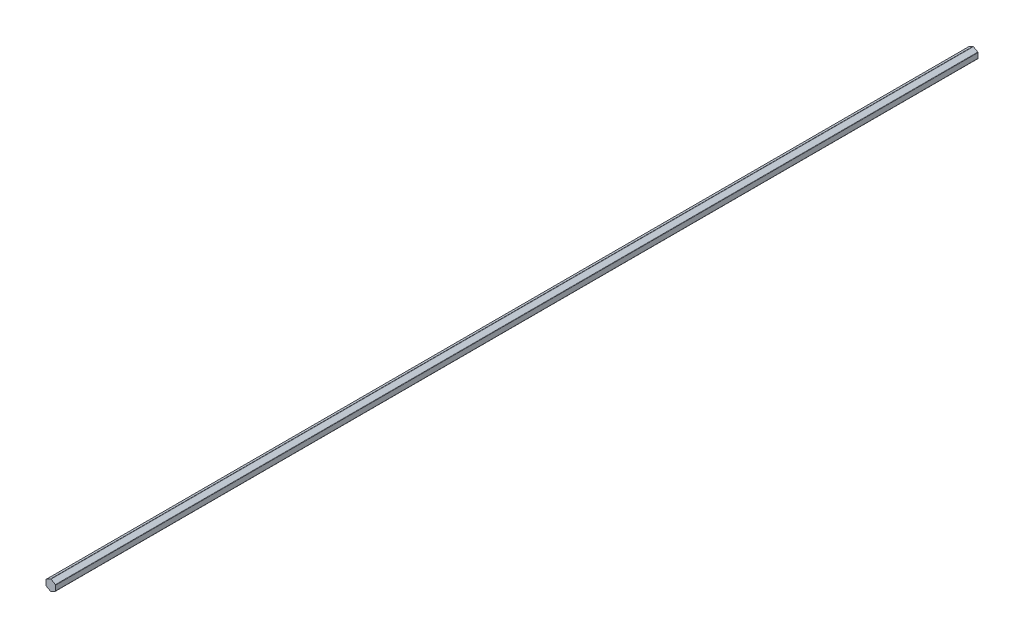
from build123d import *

# Parameters (mm, degrees)
SHAFT_BOSS_DEPTH = 914.4
FILLET1_R        = 0.508


with BuildPart() as part:
    # Sketch1 → Shaft Boss (new body)
    with BuildSketch(Plane.XY):
        Polygon((0, 5.499261314), (-4.7625, 2.749630657), (-4.7625, -2.749630657), (0, -5.499261314), (4.7625, -2.749630657), (4.7625, 2.749630657), align=None)
    extrude(amount=SHAFT_BOSS_DEPTH)

    # Fillet1
    fillet1_edges = [part.edges().sort_by_distance(p)[0] for p in [
        (4.7625, 2.749630657, 457.2),
        (4.7625, -2.749630657, 457.2),
        (0, -5.499261314, 457.2),
        (-4.7625, -2.749630657, 457.2),
        (-4.7625, 2.749630657, 457.2),
        (0, 5.499261314, 457.2),
    ]]
    fillet(fillet1_edges, radius=FILLET1_R)


solid = part.part
